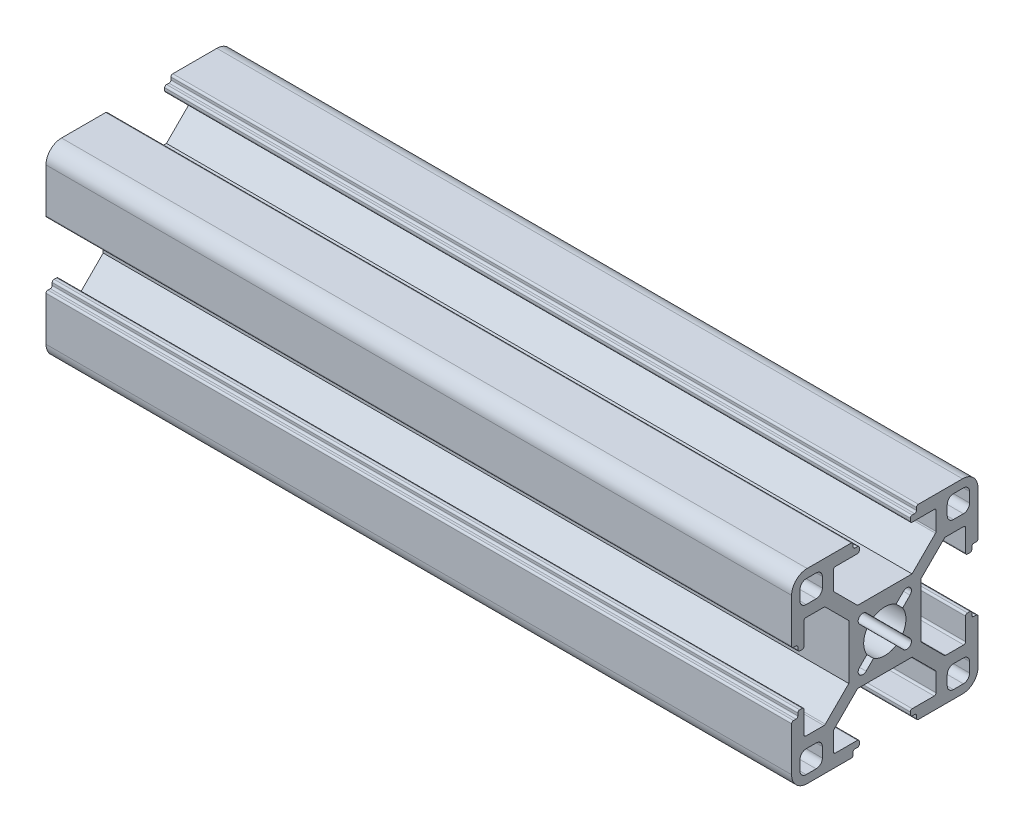
from build123d import *

# Parameters (mm, degrees)
SKETCH2_W                = 30
SKETCH2_H                = 30
BOSS_EXTRUDE1_DEPTH      = 120
SKETCH5_R                = 3.4
CUT_EXTRUDE2_DEPTH       = 122.86057607
CUT_EXTRUDE1_DEPTH       = 122.86057607
FILLET1_R                = 2.5
FILLET2_R                = 0.3
CIRPATTERN1_COUNT        = 4
FILLET1_OF_CIRPATTERN1_R = 2.5
FILLET2_OF_CIRPATTERN1_R = 0.3


with BuildPart() as part:
    # Sketch2 → Boss-Extrude1 (new body)
    with BuildSketch(Plane(origin=(0, 0, 0), x_dir=(0, 0, -1), z_dir=(1, 0, 0))):
        Rectangle(SKETCH2_W, SKETCH2_H)
    extrude(amount=BOSS_EXTRUDE1_DEPTH)

    # Sketch5 → Cut-Extrude2 (cut, through all)
    with BuildSketch(Plane(origin=(120, 0, 0), x_dir=(0, 0, -1), z_dir=(1, 0, 0))):
        Circle(SKETCH5_R)
    extrude(amount=-CUT_EXTRUDE2_DEPTH, mode=Mode.SUBTRACT)

    # Sketch4 → Cut-Extrude1 (cut, through all)
    with BuildSketch(Plane(origin=(120, 0, 0), x_dir=(0, 0, -1), z_dir=(1, 0, 0))):
        with BuildLine():
            Line((-4.385786454, -5.8), (4.385786454, -5.8))
            Line((4.385786454, -5.8), (8.162132034, -9.57634558))
            ThreePointArc((8.162132034, -9.57634558), (8.22716386, -9.673672585), (8.25, -9.788477614))
            Line((8.25, -9.788477614), (8.25, -13))
            Line((8.25, -13), (4.1, -13))
            Line((4.1, -13), (4.1, -14))
            Line((4.1, -14), (5.1, -14))
            Line((5.1, -14), (5.1, -15))
            Line((5.1, -15), (-5.1, -15))
            Line((-5.1, -15), (-5.1, -14))
            Line((-5.1, -14), (-4.1, -14))
            Line((-4.1, -14), (-4.1, -13))
            Line((-4.1, -13), (-8.25, -13))
            Line((-8.25, -13), (-8.25, -9.788477614))
            ThreePointArc((-8.25, -9.788477614), (-8.22716386, -9.673672585), (-8.162132034, -9.57634558))
            Line((-8.162132034, -9.57634558), (-4.385786454, -5.8))
        make_face()
        with BuildLine():
            Line((11.05, -10.05), (12.65, -10.05))
            ThreePointArc((12.65, -10.05), (13.357106781, -10.342893219), (13.65, -11.05))
            Line((13.65, -11.05), (13.65, -12.65))
            ThreePointArc((13.65, -12.65), (13.357106781, -13.357106781), (12.65, -13.65))
            Line((12.65, -13.65), (11.05, -13.65))
            ThreePointArc((11.05, -13.65), (10.342893219, -13.357106781), (10.05, -12.65))
            Line((10.05, -12.65), (10.05, -11.05))
            ThreePointArc((10.05, -11.05), (10.342893219, -10.342893219), (11.05, -10.05))
        make_face()
        with BuildLine():
            Line((4.065863992, -3.00520382), (2.87527145, -1.814611278))
            ThreePointArc((2.87527145, -1.814611278), (2.404163056, -2.404163056), (1.814611278, -2.87527145))
            Line((1.814611278, -2.87527145), (3.00520382, -4.065863992))
            ThreePointArc((3.00520382, -4.065863992), (4.065863992, -4.065863992), (4.065863992, -3.00520382))
        make_face()
    cut_extrude1 = extrude(amount=-CUT_EXTRUDE1_DEPTH, mode=Mode.SUBTRACT)

    # Fillet1
    fillet1_edges = [part.edges().sort_by_distance(p)[0] for p in [
        (60, -15, -15),
    ]]
    fillet(fillet1_edges, radius=FILLET1_R)

    # Fillet2
    fillet2_edges = [part.edges().sort_by_distance(p)[0] for p in [
        (60, -14, -5.1),
        (60, -15, -5.1),
        (60, -14, -4.1),
        (60, -13, -4.1),
        (60, -13, -8.25),
        (60, -13, 8.25),
        (60, -13, 4.1),
        (60, -14, 4.1),
        (60, -14, 5.1),
        (60, -15, 5.1),
    ]]
    fillet(fillet2_edges, radius=FILLET2_R)

    # CirPattern1: Cut-Extrude1 ×4 about axis
    cirpattern1_axis = Axis((0, 0, 0), (1, 0, 0))
    for i in range(1, CIRPATTERN1_COUNT):
        add(cut_extrude1.rotate(cirpattern1_axis, i * 360 / CIRPATTERN1_COUNT), mode=Mode.SUBTRACT)

    # Fillet1 of CirPattern1
    fillet1_of_cirpattern1_edges = [part.edges().sort_by_distance(p)[0] for p in [
        (60, 15, -15),
        (60, 15, 15),
        (60, -15, 15),
    ]]
    fillet(fillet1_of_cirpattern1_edges, radius=FILLET1_OF_CIRPATTERN1_R)

    # Fillet2 of CirPattern1
    fillet2_of_cirpattern1_edges = [part.edges().sort_by_distance(p)[0] for p in [
        (60, 5.1, -14),
        (60, 5.1, -15),
        (60, 4.1, -14),
        (60, 4.1, -13),
        (60, 8.25, -13),
        (60, -8.25, -13),
        (60, -4.1, -13),
        (60, -4.1, -14),
        (60, -5.1, -14),
        (60, -5.1, -15),
        (60, 14, 5.1),
        (60, 15, 5.1),
        (60, 14, 4.1),
        (60, 13, 4.1),
        (60, 13, 8.25),
        (60, 13, -8.25),
        (60, 13, -4.1),
        (60, 14, -4.1),
        (60, 14, -5.1),
        (60, 15, -5.1),
        (60, -5.1, 14),
        (60, -5.1, 15),
        (60, -4.1, 14),
        (60, -4.1, 13),
        (60, -8.25, 13),
        (60, 8.25, 13),
        (60, 4.1, 13),
        (60, 4.1, 14),
        (60, 5.1, 14),
        (60, 5.1, 15),
    ]]
    fillet(fillet2_of_cirpattern1_edges, radius=FILLET2_OF_CIRPATTERN1_R)


solid = part.part
